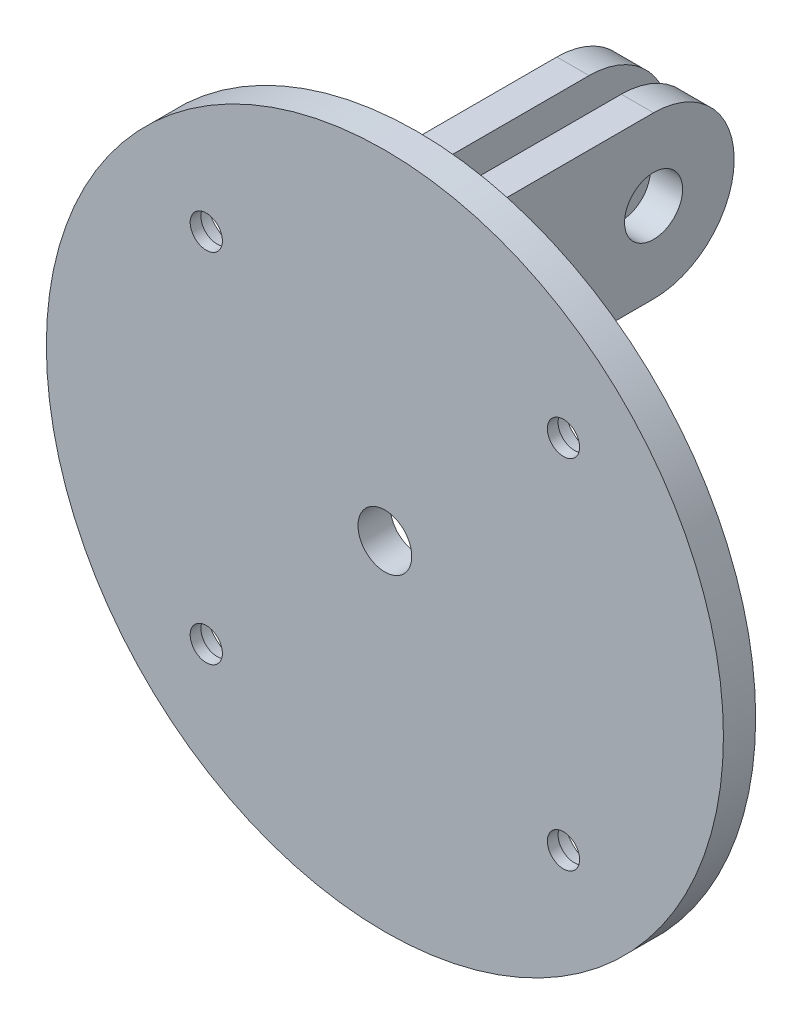
from build123d import *

# Parameters (mm, degrees)
CROQUIS1_R              = 31.5
CROQUIS1_R_2            = 1.5
SALIENTE_EXTRUIR1_DEPTH = 3
CROQUIS4_R              = 2.5
CORTAR_EXTRUIR3_DEPTH   = 3
CROQUIS5_W              = 3
CROQUIS5_H              = 15
SALIENTE_EXTRUIR2_DEPTH = 25
CORTAR_EXTRUIR4_START   = -9
CROQUIS6_R              = 2.7
CORTAR_EXTRUIR4_DEPTH   = 9
CROQUIS7_R              = 3
CORTAR_EXTRUIR5_DEPTH   = 2


with BuildPart() as part:
    # Croquis1 → Saliente-Extruir1 (new body)
    with BuildSketch(Plane.XY):
        with Locations((-43.449193048, 8.207110309)):
            Circle(CROQUIS1_R)
        with Locations((-60.066202406, 24.824119667)):
            Circle(CROQUIS1_R_2, mode=Mode.SUBTRACT)
        with Locations((-26.83218369, 24.824119667)):
            Circle(CROQUIS1_R_2, mode=Mode.SUBTRACT)
        with Locations((-26.83218369, -8.409899049)):
            Circle(CROQUIS1_R_2, mode=Mode.SUBTRACT)
        with Locations((-60.066202406, -8.409899049)):
            Circle(CROQUIS1_R_2, mode=Mode.SUBTRACT)
    extrude(amount=SALIENTE_EXTRUIR1_DEPTH)

    # Croquis4 → Cortar-Extruir3 (cut)
    with BuildSketch(Plane(origin=(0, 0, 0), x_dir=(-1, 0, 0), z_dir=(0, 0, -1))):
        with Locations((43.449193048, 8.207110309)):
            Circle(CROQUIS4_R)
    extrude(amount=-CORTAR_EXTRUIR3_DEPTH, mode=Mode.SUBTRACT)

    # Croquis5 → Saliente-Extruir2 (add)
    with BuildSketch(Plane(origin=(0, 0, 0), x_dir=(-1, 0, 0), z_dir=(0, 0, -1))):
        with Locations((40.449193048, 27.207110309)):
            Rectangle(CROQUIS5_W, CROQUIS5_H)
        with Locations((46.449193048, 27.207110309)):
            Rectangle(CROQUIS5_W, CROQUIS5_H)
    extrude(amount=SALIENTE_EXTRUIR2_DEPTH)

    # Croquis6 → Cortar-Extruir4 (cut)
    with BuildSketch(Plane(origin=(-38.949193048, 0, 0), x_dir=(0, 0, -1), z_dir=(1, 0, 0)).offset(CORTAR_EXTRUIR4_START)):
        with BuildLine():
            Line((25, 34.707110309), (17.5, 34.707110309))
            ThreePointArc((17.5, 34.707110309), (22.803300859, 32.510411168), (25, 27.207110309))
            Line((25, 27.207110309), (25, 34.707110309))
        make_face()
        with BuildLine():
            Line((25, 19.707110309), (25, 27.207110309))
            ThreePointArc((25, 27.207110309), (22.803300859, 21.90380945), (17.5, 19.707110309))
            Line((17.5, 19.707110309), (25, 19.707110309))
        make_face()
        with Locations(Location((17.5, 27.207110309, 0), (0, 0, 90))):
            Circle(CROQUIS6_R)
    extrude(amount=CORTAR_EXTRUIR4_DEPTH, mode=Mode.SUBTRACT)

    # Croquis7 → Cortar-Extruir5 (cut)
    with BuildSketch(Plane(origin=(0, 0, 0), x_dir=(-1, 0, 0), z_dir=(0, 0, -1))):
        with Locations((26.83218369, 24.824119667)):
            Circle(CROQUIS7_R)
        with Locations((60.066202406, 24.824119667)):
            Circle(CROQUIS7_R)
        with Locations((60.066202406, -8.409899049)):
            Circle(CROQUIS7_R)
        with Locations((26.83218369, -8.409899049)):
            Circle(CROQUIS7_R)
    extrude(amount=-CORTAR_EXTRUIR5_DEPTH, mode=Mode.SUBTRACT)


solid = part.part
